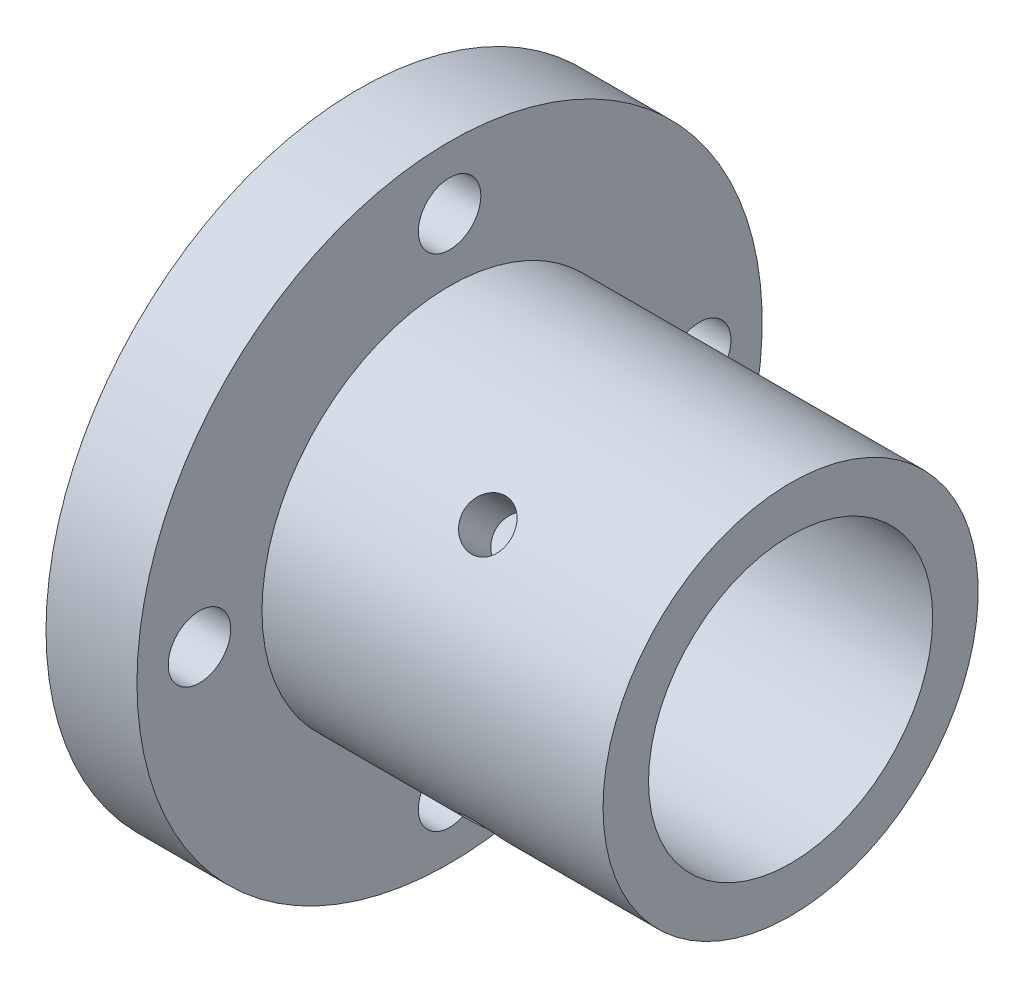
from build123d import *

# Parameters (mm, degrees)
TAPPED_HOLE1_REACH  = 103.897
TAPPED_HOLE1_BORE_R = 2.1
CIRPATTERN1_COUNT   = 2
CIRPATTERN1_ANGLE   = 90
DIAMETER_HOLE1_D    = 5.5
DIAMETER_HOLE2_D    = 5.5


with BuildPart() as part:
    # Sketch1 → Revolve1 (revolve)
    with BuildSketch(Plane.XY, mode=Mode.PRIVATE) as revolve1_sk:
        Polygon((0, 12.5), (0, 27.5), (8, 27.5), (8, 16.5), (38, 16.5), (38, 12.5), align=None)
    revolve(revolve1_sk.sketch.rotate(Axis((0, 0, 0), (1, 0, 0)), 90), axis=Axis((0, 0, 0), (1, 0, 0)))

    # Tapped Hole1 bore → Tapped Hole1 (cut, up to next)
    with BuildSketch(Plane(origin=(84.688297546, 3.217458949, 20.11706483), x_dir=(1, 0, 0), z_dir=(0, 0.7071067811865488, 0.7071067811865464)), mode=Mode.PRIVATE) as tapped_hole1_sk1:
        with Locations((-61.688297546, 11.949825918)):
            Circle(TAPPED_HOLE1_BORE_R)
    tapped_hole1_tool1 = extrude(tapped_hole1_sk1.sketch, amount=-TAPPED_HOLE1_REACH, mode=Mode.PRIVATE) & part.part
    tapped_hole1 = tapped_hole1_tool1.solids().sort_by_distance((23, 11.667262, 11.667262))[0]
    add(tapped_hole1, mode=Mode.SUBTRACT)

    # CirPattern1: Tapped Hole1 ×2 about axis
    cirpattern1_axis = Axis((0, 0, 0), (1, 0, 0))
    for i in range(1, CIRPATTERN1_COUNT):
        add(tapped_hole1.rotate(cirpattern1_axis, i * CIRPATTERN1_ANGLE / (CIRPATTERN1_COUNT - 1)), mode=Mode.SUBTRACT)

    # Diameter Hole1 (through all)
    with Locations(Plane(origin=(8, 0, 0), x_dir=(0, 0, -1), z_dir=(1, 0, 0))):
        with Locations((0, 22), (0, -22)):
            Hole(DIAMETER_HOLE1_D / 2)

    # Diameter Hole2 (through all)
    with Locations(Plane(origin=(8, 0, 0), x_dir=(0, 0, -1), z_dir=(1, 0, 0))):
        with Locations((-22, 0), (22, 0)):
            Hole(DIAMETER_HOLE2_D / 2)


solid = part.part
